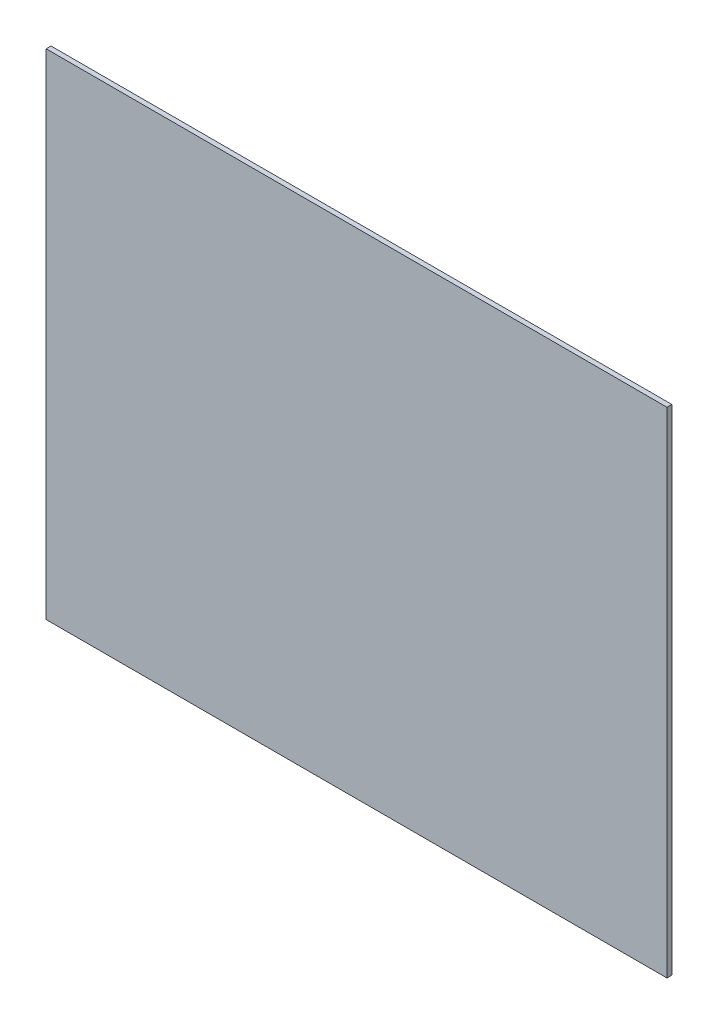
from build123d import *

# Parameters (mm, degrees)
ESQUISSE1_W        = 832
ESQUISSE1_H        = 662.5
BOSS_EXTRU_1_DEPTH = 6.5


with BuildPart() as part:
    # Esquisse1 → Boss.-Extru.1 (new body)
    with BuildSketch(Plane.XY):
        Rectangle(ESQUISSE1_W, ESQUISSE1_H)
    extrude(amount=BOSS_EXTRU_1_DEPTH)


solid = part.part
